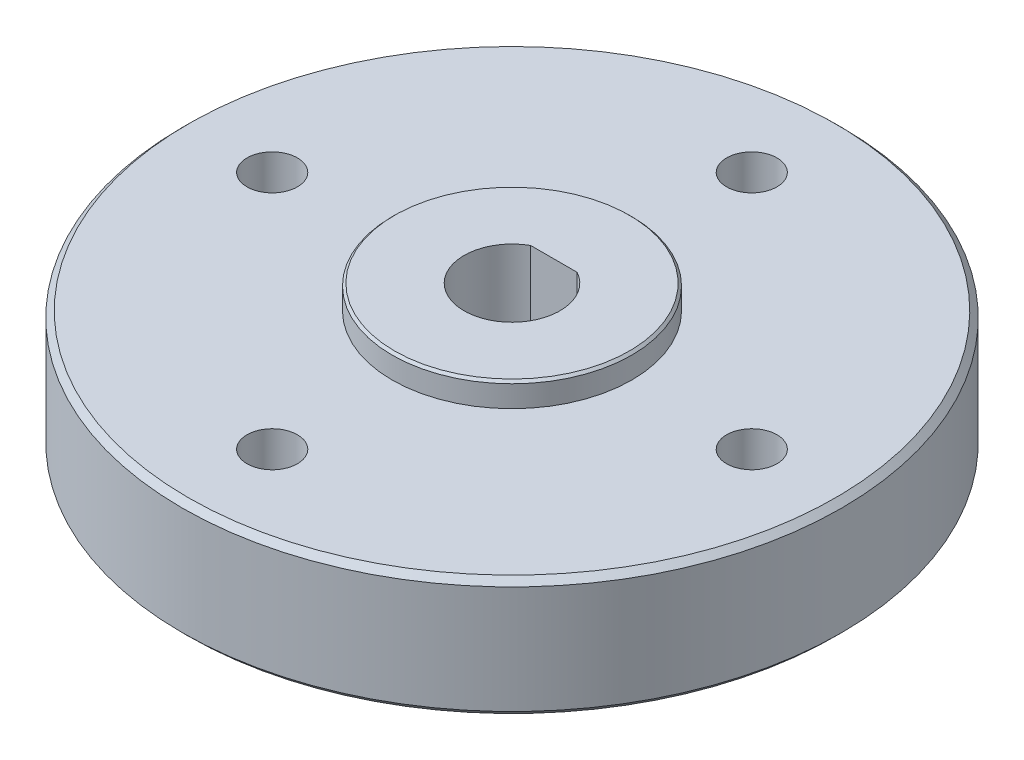
from build123d import *

# Parameters (mm, degrees)
ESQUISSE1_R                               = 10
BOSS_EXTRU_1_DEPTH                        = 10
D_GAGEMENT_M41_D                          = 4.3
D_GAGEMENT_M41_DEPTH                      = 8
D_GAGEMENT_M41_TIP                        = 1.291850331
ESQUISSE4_R                               = 27.5
BOSS_EXTRU_2_DEPTH                        = 10
ESQUISSE5_R                               = 10
BOSS_EXTRU_3_DEPTH                        = 2
TROU_POUR_TARAUDAGE_POUR_TROU_TARAUD_M5_D = 4.2
R_P_TITION_CIRCULAIRE1_COUNT              = 4
CHANFREIN1_SIZE                           = 0.5
CHANFREIN2_SIZE                           = 0.2


with BuildPart() as part:
    # Esquisse1 → Boss.-Extru.1 (new body)
    with BuildSketch(Plane(origin=(0, 0, 0), x_dir=(1, 0, 0), z_dir=(0, 1, 0))):
        Circle(ESQUISSE1_R)
        with BuildLine():
            Line((-1.936491673, 3.5), (1.936491673, 3.5))
            ThreePointArc((1.936491673, 3.5), (0, -4), (-1.936491673, 3.5))
        make_face(mode=Mode.SUBTRACT)
    extrude(amount=BOSS_EXTRU_1_DEPTH)

    # Dégagement M41
    with Locations(Plane(origin=(0, 0, -10), x_dir=(-1, 0, 0), z_dir=(0, 0, -1))):
        with Locations((0, 5)):
            Hole(D_GAGEMENT_M41_D / 2, depth=D_GAGEMENT_M41_DEPTH)
            with Locations((0, 0, -(D_GAGEMENT_M41_DEPTH + D_GAGEMENT_M41_TIP / 2))):  # 118° drill point
                Cone(0, D_GAGEMENT_M41_D / 2, D_GAGEMENT_M41_TIP, mode=Mode.SUBTRACT)

    # Esquisse4 → Boss.-Extru.2 (add)
    with BuildSketch(Plane(origin=(0, 10, 0), x_dir=(1, 0, 0), z_dir=(0, 1, 0))):
        Circle(ESQUISSE4_R)
        with BuildLine():
            Line((-1.936491673, 3.5), (1.936491673, 3.5))
            ThreePointArc((1.936491673, 3.5), (0, -4), (-1.936491673, 3.5))
        make_face(mode=Mode.SUBTRACT)
    extrude(amount=BOSS_EXTRU_2_DEPTH)

    # Esquisse5 → Boss.-Extru.3 (add)
    with BuildSketch(Plane(origin=(0, 20, 0), x_dir=(1, 0, 0), z_dir=(0, 1, 0))):
        Circle(ESQUISSE5_R)
        with BuildLine():
            Line((-1.936491673, 3.5), (1.936491673, 3.5))
            ThreePointArc((1.936491673, 3.5), (0, -4), (-1.936491673, 3.5))
        make_face(mode=Mode.SUBTRACT)
    extrude(amount=BOSS_EXTRU_3_DEPTH)

    # Trou pour taraudage pour trou taraudé M51 (through all)
    with Locations(Plane(origin=(0, 20, 0), x_dir=(1, 0, 0), z_dir=(0, 1, 0))):
        with Locations((0, -20)):
            trou_pour_taraudage_pour_trou_taraud_m5 = Hole(TROU_POUR_TARAUDAGE_POUR_TROU_TARAUD_M5_D / 2)

    # Répétition circulaire1: Trou pour taraudage pour trou taraudé M51 ×4 about axis
    r_p_tition_circulaire1_axis = Axis((0, 22, 0), (0, -1, 0))
    for i in range(1, R_P_TITION_CIRCULAIRE1_COUNT):
        add(trou_pour_taraudage_pour_trou_taraud_m5.rotate(r_p_tition_circulaire1_axis, i * 360 / R_P_TITION_CIRCULAIRE1_COUNT), mode=Mode.SUBTRACT)

    # Chanfrein1
    chanfrein1_edges = [part.edges().sort_by_distance(p)[0] for p in [
        (-10, 0, 0),
        (-27.5, 10, 0),
        (-27.5, 20, 0),
    ]]
    chamfer(chanfrein1_edges, length=CHANFREIN1_SIZE)

    # Chanfrein2
    chanfrein2_edges = [part.edges().sort_by_distance(p)[0] for p in [
        (-10, 22, 0),
    ]]
    chamfer(chanfrein2_edges, length=CHANFREIN2_SIZE)


solid = part.part
